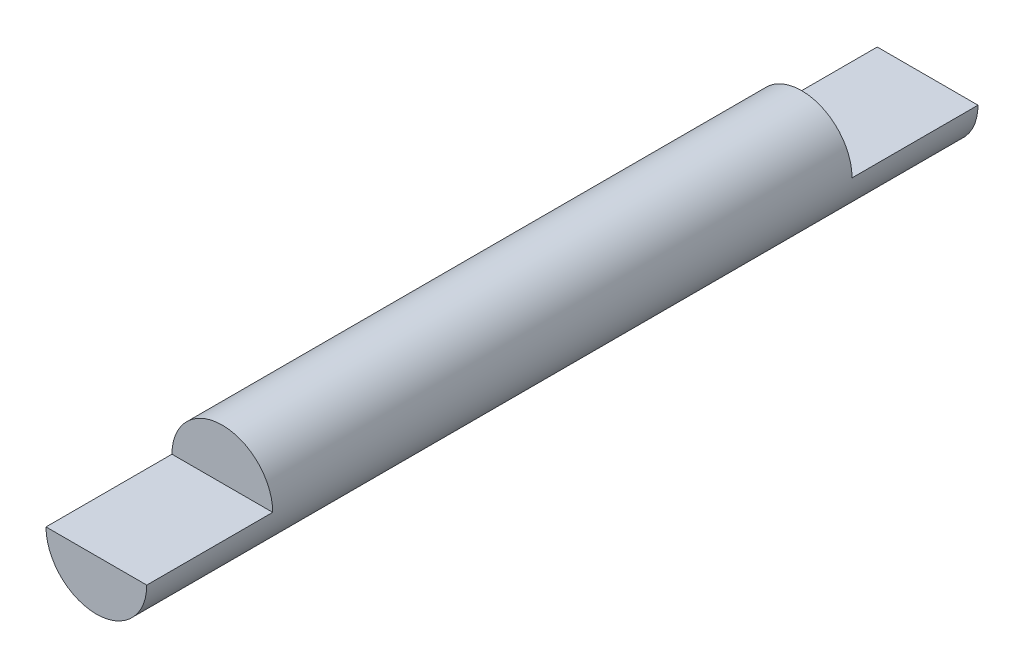
from build123d import *

# Parameters (mm, degrees)
ESQUISSE1_R             = 2
BOSS_EXTRU_1_DEPTH      = 33
ESQUISSE2_W             = 4
ESQUISSE2_H             = 3
ENL_V_MAT_EXTRU_1_DEPTH = 5


with BuildPart() as part:
    # Esquisse1 → Boss.-Extru.1 (new body)
    with BuildSketch(Plane.XY):
        Circle(ESQUISSE1_R)
    extrude(amount=BOSS_EXTRU_1_DEPTH)

    # Esquisse2 → Enlèv. mat.-Extru.1 (cut)
    with BuildSketch(Plane(origin=(0, 0, 0), x_dir=(-1, 0, 0), z_dir=(0, 0, -1))):
        with Locations((0, 1.5)):
            Rectangle(ESQUISSE2_W, ESQUISSE2_H)
    enl_v_mat_extru_1 = extrude(amount=-ENL_V_MAT_EXTRU_1_DEPTH, mode=Mode.SUBTRACT)

    # Symétrie1: Enlèv. mat.-Extru.1 across plane
    add(enl_v_mat_extru_1.mirror(Plane.XY.offset(16.5)), mode=Mode.SUBTRACT)


solid = part.part
